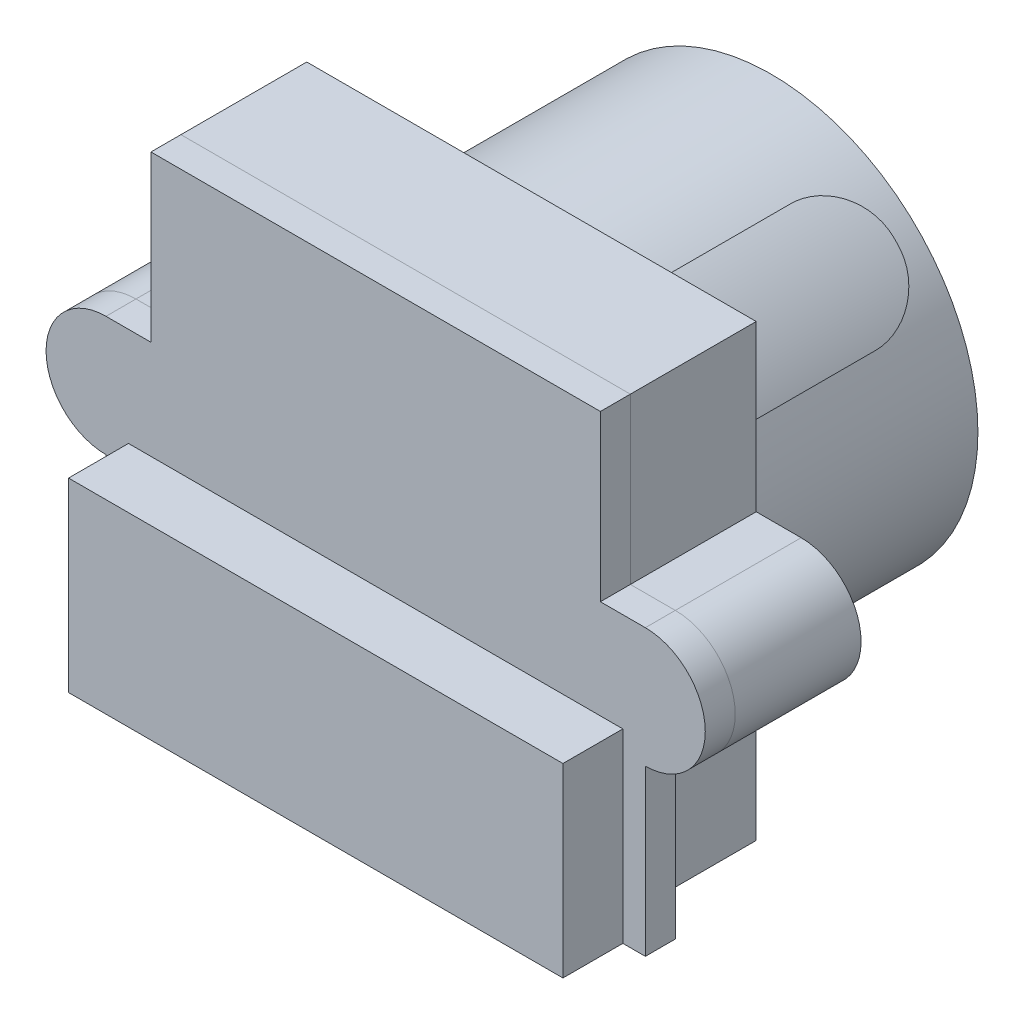
from build123d import *

# Parameters (mm, degrees)
BOSS_EXTRUDE1_DEPTH      = 8
BOSS_EXTRUDE2_DEPTH      = 6.5
FILLET1_R                = 1.905
TAP_DRILL_FOR_M12_TAP1_D = 10.2
SKETCH4_R                = 0.5
BOSS_EXTRUDE3_DEPTH      = 4.2
BOSS_EXTRUDE4_DEPTH      = 1
SKETCH6_W                = 16.5
SKETCH6_H                = 6.2
BOSS_EXTRUDE5_DEPTH      = 2


with BuildPart() as part:
    # Sketch1 → Boss-Extrude1 (new body)
    with BuildSketch(Plane.XY):
        with BuildLine():
            ThreePointArc((6.083795985, 3.25536886), (4.87903679, 4.87903679), (3.25536886, 6.083795985))
            ThreePointArc((3.25536886, 6.083795985), (-5.919123463, -3.545980461), (6.9, 0))
            ThreePointArc((6.9, 0), (6.692839169, 1.678065509), (6.083795985, 3.25536886))
        make_face()
    extrude(amount=-BOSS_EXTRUDE1_DEPTH)

    # Sketch1<3> → Boss-Extrude2 (add)
    with BuildSketch(Plane.XY):
        with BuildLine():
            Line((4.063012013, 6.891439137), (3.25536886, 6.083795985))
            ThreePointArc((3.25536886, 6.083795985), (4.87903679, 4.87903679), (6.083795985, 3.25536886))
            Line((6.083795985, 3.25536886), (6.891439137, 4.063012013))
            ThreePointArc((6.891439137, 4.063012013), (5.656854249, 5.656854249), (4.063012013, 6.891439137))
        make_face()
    extrude(amount=-BOSS_EXTRUDE2_DEPTH)

    # Fillet1
    fillet1_edges = [part.edges().sort_by_distance(p)[0] for p in [
        (3.659190436, 6.487617561, -6.5),
        (6.487617561, 3.659190436, -6.5),
    ]]
    fillet(fillet1_edges, radius=FILLET1_R)

    # Tap Drill for M12 Tap1 (through all)
    with Locations(Plane(origin=(0, 0, -8), x_dir=(-1, 0, 0), z_dir=(0, 0, -1))):
        with Locations((0, 0)):
            Hole(TAP_DRILL_FOR_M12_TAP1_D / 2)

    # Sketch4 → Boss-Extrude3 (add)
    with BuildSketch(Plane.XY):
        with BuildLine():
            Line((-7.5, 7.5), (7.5, 7.5))
            Line((7.5, 7.5), (7.5, 2))
            Line((7.5, 2), (9, 2))
            ThreePointArc((9, 2), (11, 0), (9, -2))
            Line((9, -2), (7.5, -2))
            Line((7.5, -2), (7.5, -7.5))
            Line((7.5, -7.5), (-7.5, -7.5))
            Line((-7.5, -7.5), (-7.5, -2))
            Line((-7.5, -2), (-9, -2))
            ThreePointArc((-9, -2), (-11, 0), (-9, 2))
            Line((-9, 2), (-7.5, 2))
            Line((-7.5, 2), (-7.5, 7.5))
        make_face()
        with Locations((9, 0)):
            Circle(SKETCH4_R, mode=Mode.SUBTRACT)
        with Locations((-9, 0)):
            Circle(SKETCH4_R, mode=Mode.SUBTRACT)
    extrude(amount=BOSS_EXTRUDE3_DEPTH)


with BuildPart() as body_2:
    # Sketch5 → Boss-Extrude4 (new body)
    with BuildSketch(Plane.XY.offset(4.2)):
        with BuildLine():
            Line((9, -2), (9, -7.5))
            Line((9, -7.5), (-9, -7.5))
            Line((-9, -7.5), (-9, -2))
            ThreePointArc((-9, -2), (-11, 0), (-9, 2))
            Line((-9, 2), (-7.5, 2))
            Line((-7.5, 2), (-7.5, 7.5))
            Line((-7.5, 7.5), (7.5, 7.5))
            Line((7.5, 7.5), (7.5, 2))
            Line((7.5, 2), (9, 2))
            ThreePointArc((9, 2), (11, 0), (9, -2))
        make_face()
    extrude(amount=BOSS_EXTRUDE4_DEPTH)


with BuildPart() as body_3:
    # Sketch6 → Boss-Extrude5 (new body)
    with BuildSketch(Plane.XY.offset(5.2)):
        with Locations((0, -4.4)):
            Rectangle(SKETCH6_W, SKETCH6_H)
    extrude(amount=BOSS_EXTRUDE5_DEPTH)


solid = Compound([part.part, body_2.part, body_3.part])
